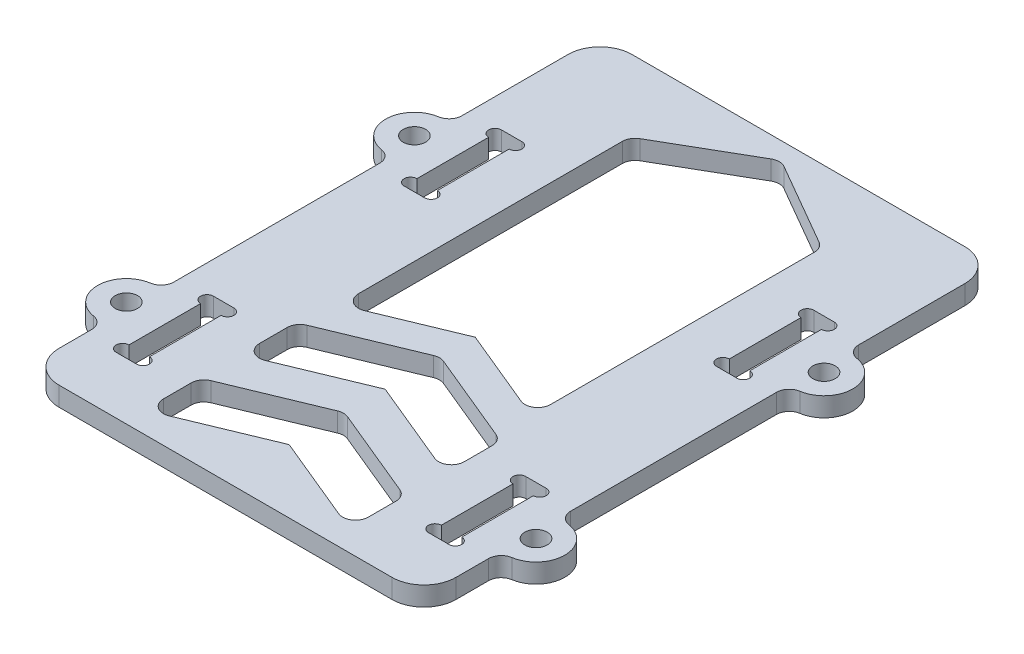
from build123d import *

# Parameters (mm, degrees)
SKETCH_1_R          = 1.65
EXTRUDE_1_DEPTH     = 3
SKETCH_3_W          = 62
SKETCH_3_H          = 11.5
EXTRUDE_2_DEPTH     = 3
FILLET_1_R          = 5
CUT_EXTRUDE_1_DEPTH = 10
SKETCH_4_R          = 4.5
SKETCH_4_R_2        = 1.75
EXTRUDE_3_DEPTH     = 3
FILLET_2_R          = 2
SKETCH_5_R          = 1.75
CUT_EXTRUDE_2_DEPTH = 3
SKETCH_6_OUTSIDE_W  = 115.11
SKETCH_6_OUTSIDE_H  = 116.61
CUT_EXTRUDE_4_DEPTH = 10
FILLET_3_R          = 5


with BuildPart() as part:
    # 草图1 → 凸台-拉伸1 (new body)
    with BuildSketch(Plane(origin=(0, 0, 0), x_dir=(1, 0, 0), z_dir=(0, 1, 0))):
        with BuildLine():
            Line((-42, 39), (42, 39))
            ThreePointArc((42, 39), (43.414213562, 38.414213562), (44, 37))
            Line((44, 37), (44, 33))
            ThreePointArc((44, 33), (43.414213562, 31.585786438), (42, 31))
            Line((42, 31), (33, 31))
            ThreePointArc((33, 31), (31.585786438, 30.414213562), (31, 29))
            Line((31, 29), (31, -29))
            ThreePointArc((31, -29), (31.585786438, -30.414213562), (33, -31))
            Line((33, -31), (42, -31))
            ThreePointArc((42, -31), (43.414213562, -31.585786438), (44, -33))
            Line((44, -33), (44, -37))
            ThreePointArc((44, -37), (43.414213562, -38.414213562), (42, -39))
            Line((42, -39), (-42, -39))
            ThreePointArc((-42, -39), (-43.414213562, -38.414213562), (-44, -37))
            Line((-44, -37), (-44, -33))
            ThreePointArc((-44, -33), (-43.414213562, -31.585786438), (-42, -31))
            Line((-42, -31), (-33, -31))
            ThreePointArc((-33, -31), (-31.585786438, -30.414213562), (-31, -29))
            Line((-31, -29), (-31, 29))
            ThreePointArc((-31, 29), (-31.585786438, 30.414213562), (-33, 31))
            Line((-33, 31), (-42, 31))
            ThreePointArc((-42, 31), (-43.414213562, 31.585786438), (-44, 33))
            Line((-44, 33), (-44, 37))
            ThreePointArc((-44, 37), (-43.414213562, 38.414213562), (-42, 39))
        make_face()
        with Locations(Location((-40, 35, 0), (0, 0, 270))):
            Circle(SKETCH_1_R, mode=Mode.SUBTRACT)
        with Locations(Location((40, 35, 0), (0, 0, 270))):
            Circle(SKETCH_1_R, mode=Mode.SUBTRACT)
        with Locations(Location((-40, -35, 0), (0, 0, 270))):
            Circle(SKETCH_1_R, mode=Mode.SUBTRACT)
        with Locations(Location((40, -35, 0), (0, 0, 270))):
            Circle(SKETCH_1_R, mode=Mode.SUBTRACT)
        with BuildLine():
            Line((-22.8, 30.1), (-26, 30.1))
            ThreePointArc((-26, 30.1), (-27, 29.1), (-26, 28.1))
            Line((-26, 28.1), (-26, 16.9))
            ThreePointArc((-26, 16.9), (-27, 15.9), (-26, 14.9))
            Line((-26, 14.9), (-22.8, 14.9))
            ThreePointArc((-22.8, 14.9), (-21.8, 15.9), (-22.8, 16.9))
            Line((-22.8, 16.9), (-22.8, 28.1))
            ThreePointArc((-22.8, 28.1), (-21.8, 29.1), (-22.8, 30.1))
        make_face(mode=Mode.SUBTRACT)
        with BuildLine():
            Line((22.8, 30.1), (26, 30.1))
            ThreePointArc((26, 30.1), (27, 29.1), (26, 28.1))
            Line((26, 28.1), (26, 16.9))
            ThreePointArc((26, 16.9), (27, 15.9), (26, 14.9))
            Line((26, 14.9), (22.8, 14.9))
            ThreePointArc((22.8, 14.9), (21.8, 15.9), (22.8, 16.9))
            Line((22.8, 16.9), (22.8, 28.1))
            ThreePointArc((22.8, 28.1), (21.8, 29.1), (22.8, 30.1))
        make_face(mode=Mode.SUBTRACT)
        with BuildLine():
            Line((22.8, -30.1), (26, -30.1))
            ThreePointArc((26, -30.1), (27, -29.1), (26, -28.1))
            Line((26, -28.1), (26, -16.9))
            ThreePointArc((26, -16.9), (27, -15.9), (26, -14.9))
            Line((26, -14.9), (22.8, -14.9))
            ThreePointArc((22.8, -14.9), (21.8, -15.9), (22.8, -16.9))
            Line((22.8, -16.9), (22.8, -28.1))
            ThreePointArc((22.8, -28.1), (21.8, -29.1), (22.8, -30.1))
        make_face(mode=Mode.SUBTRACT)
        with BuildLine():
            Line((-22.8, -30.1), (-26, -30.1))
            ThreePointArc((-26, -30.1), (-27, -29.1), (-26, -28.1))
            Line((-26, -28.1), (-26, -16.9))
            ThreePointArc((-26, -16.9), (-27, -15.9), (-26, -14.9))
            Line((-26, -14.9), (-22.8, -14.9))
            ThreePointArc((-22.8, -14.9), (-21.8, -15.9), (-22.8, -16.9))
            Line((-22.8, -16.9), (-22.8, -28.1))
            ThreePointArc((-22.8, -28.1), (-21.8, -29.1), (-22.8, -30.1))
        make_face(mode=Mode.SUBTRACT)
    extrude(amount=EXTRUDE_1_DEPTH)

    # 草图3 → 凸台-拉伸2 (add)
    with BuildSketch(Plane(origin=(0, 3, 0), x_dir=(1, 0, 0), z_dir=(0, 1, 0))):
        with Locations((0, 44.75)):
            Rectangle(SKETCH_3_W, SKETCH_3_H)
    extrude(amount=-EXTRUDE_2_DEPTH)

    # 圆角1
    fillet_1_edges = [part.edges().sort_by_distance(p)[0] for p in [
        (31, 1.5, -50.5),
        (31, 1.5, -39),
        (-31, 1.5, -39),
        (-31, 1.5, -50.5),
    ]]
    fillet(fillet_1_edges, radius=FILLET_1_R)

    # 草图2 → 切除-拉伸1 (cut)
    with BuildSketch(Plane(origin=(0, 3, 0), x_dir=(1, 0, 0), z_dir=(0, 1, 0))):
        with BuildLine():
            Line((-1, 47.232050808), (-14, 39.726497308))
            ThreePointArc((-14, 39.726497308), (-14.732050808, 38.994446501), (-15, 37.994446501))
            Line((-15, 37.994446501), (-15, -3.21999191))
            ThreePointArc((-15, -3.21999191), (-14.111140466, -4.882931135), (-12.234633135, -5.067750975))
            Line((-12.234633135, -5.067750975), (0, 0))
            Line((0, 0), (12.234633135, -5.067750975))
            ThreePointArc((12.234633135, -5.067750975), (14.111140466, -4.882931135), (15, -3.21999191))
            Line((15, -3.21999191), (15, 37.994446501))
            ThreePointArc((15, 37.994446501), (14.732050808, 38.994446501), (14, 39.726497308))
            Line((14, 39.726497308), (1, 47.232050808))
            ThreePointArc((1, 47.232050808), (0, 47.5), (-1, 47.232050808))
        make_face()
        with BuildLine():
            Line((-0.765366865, -5.728986337), (-14.765366865, -11.52797621))
            ThreePointArc((-14.765366865, -11.52797621), (-15.662939225, -12.264594809), (-16, -13.375735275))
            Line((-16, -13.375735275), (-16, -17.705304076))
            ThreePointArc((-16, -17.705304076), (-15.111140466, -19.368243301), (-13.234633135, -19.553063141))
            Line((-13.234633135, -19.553063141), (0, -14.071098604))
            Line((0, -14.071098604), (13.234633135, -19.553063141))
            ThreePointArc((13.234633135, -19.553063141), (15.111140466, -19.368243301), (16, -17.705304076))
            Line((16, -17.705304076), (16, -13.375735275))
            ThreePointArc((16, -13.375735275), (15.662939225, -12.264594809), (14.765366865, -11.52797621))
            Line((14.765366865, -11.52797621), (0.765366865, -5.728986337))
            ThreePointArc((0.765366865, -5.728986337), (0, -5.576745402), (-0.765366865, -5.728986337))
        make_face()
        with BuildLine():
            Line((14.765366865, -26.52797621), (0.765366865, -20.728986337))
            ThreePointArc((0.765366865, -20.728986337), (0, -20.576745402), (-0.765366865, -20.728986337))
            Line((-0.765366865, -20.728986337), (-14.765366865, -26.52797621))
            ThreePointArc((-14.765366865, -26.52797621), (-15.662939225, -27.264594809), (-16, -28.375735275))
            Line((-16, -28.375735275), (-16, -32.705304076))
            ThreePointArc((-16, -32.705304076), (-15.111140466, -34.368243301), (-13.234633135, -34.553063141))
            Line((-13.234633135, -34.553063141), (0, -29.071098604))
            Line((0, -29.071098604), (13.234633135, -34.553063141))
            ThreePointArc((13.234633135, -34.553063141), (15.111140466, -34.368243301), (16, -32.705304076))
            Line((16, -32.705304076), (16, -28.375735275))
            ThreePointArc((16, -28.375735275), (15.662939225, -27.264594809), (14.765366865, -26.52797621))
        make_face()
    extrude(amount=-CUT_EXTRUDE_1_DEPTH, mode=Mode.SUBTRACT)

    # 草图4 → 凸台-拉伸3 (add)
    # profile 1 of 4: a face of its own
    with BuildSketch(Plane(origin=(0, 3, 0), x_dir=(1, 0, 0), z_dir=(0, 1, 0))):
        with Locations((-32, 22.5)):
            Circle(SKETCH_4_R)
        with Locations((-32, 22.5)):
            Circle(SKETCH_4_R_2, mode=Mode.SUBTRACT)
    # profile 2 of 4: a face of its own
    with BuildSketch(Plane(origin=(0, 3, 0), x_dir=(1, 0, 0), z_dir=(0, 1, 0))):
        with Locations((32, 22.5)):
            Circle(SKETCH_4_R)
        with Locations((32, 22.5)):
            Circle(SKETCH_4_R_2, mode=Mode.SUBTRACT)
    # profile 3 of 4: a face of its own
    with BuildSketch(Plane(origin=(0, 3, 0), x_dir=(1, 0, 0), z_dir=(0, 1, 0))):
        with Locations((32, -22.5)):
            Circle(SKETCH_4_R)
        with Locations((32, -22.5)):
            Circle(SKETCH_4_R_2, mode=Mode.SUBTRACT)
    # profile 4 of 4: a face of its own
    with BuildSketch(Plane(origin=(0, 3, 0), x_dir=(1, 0, 0), z_dir=(0, 1, 0))):
        with Locations((-32, -22.5)):
            Circle(SKETCH_4_R)
        with Locations((-32, -22.5)):
            Circle(SKETCH_4_R_2, mode=Mode.SUBTRACT)
    extrude(amount=-EXTRUDE_3_DEPTH)

    # 圆角2
    fillet_2_edges = [part.edges().sort_by_distance(p)[0] for p in [
        (-31, 1.5, -18.112517806),
        (-31, 1.5, -26.887482194),
        (31, 1.5, -26.887482194),
        (31, 1.5, -18.112517806),
        (31, 1.5, 26.887482194),
        (31, 1.5, 18.112517806),
        (-31, 1.5, 26.887482194),
        (-31, 1.5, 18.112517806),
    ]]
    fillet(fillet_2_edges, radius=FILLET_2_R)

    # 草图5 → 切除-拉伸2 (cut)
    with BuildSketch(Plane(origin=(0, 3, 0), x_dir=(1, 0, 0), z_dir=(0, 1, 0))):
        with Locations(Location((-32, 22.5, 0), (0, 0, 270))):
            Circle(SKETCH_5_R)
        with Locations(Location((32, 22.5, 0), (0, 0, 270))):
            Circle(SKETCH_5_R)
        with Locations(Location((32, -22.5, 0), (0, 0, 270))):
            Circle(SKETCH_5_R)
        with Locations(Location((-32, -22.5, 0), (0, 0, 270))):
            Circle(SKETCH_5_R)
    extrude(amount=-CUT_EXTRUDE_2_DEPTH, mode=Mode.SUBTRACT)

    # 草图6 outside → 切除-拉伸4 (cut)
    with BuildSketch(Plane(origin=(0, 3, 0), x_dir=(1, 0, 0), z_dir=(0, 1, 0))):
        with Locations((0, 5.75)):
            Rectangle(SKETCH_6_OUTSIDE_W, SKETCH_6_OUTSIDE_H)
        Polygon((-31, 45.5), (-31, 28.922616289), (-44.52716968, 28.922616289), (-44.52716968, -29), (-31, -29), (-31, -39), (31, -39), (31, -28.922616289), (42.852208754, -28.922616289), (42.852208754, 29), (31, 29), (31, 45.5), (31, 52.188575174), (-31, 52.188575174), align=None, mode=Mode.SUBTRACT)
    extrude(amount=-CUT_EXTRUDE_4_DEPTH, mode=Mode.SUBTRACT)

    # 圆角3
    fillet_3_edges = [part.edges().sort_by_distance(p)[0] for p in [
        (-31, 1.5, 39),
        (31, 1.5, 39),
    ]]
    fillet(fillet_3_edges, radius=FILLET_3_R)


solid = part.part
